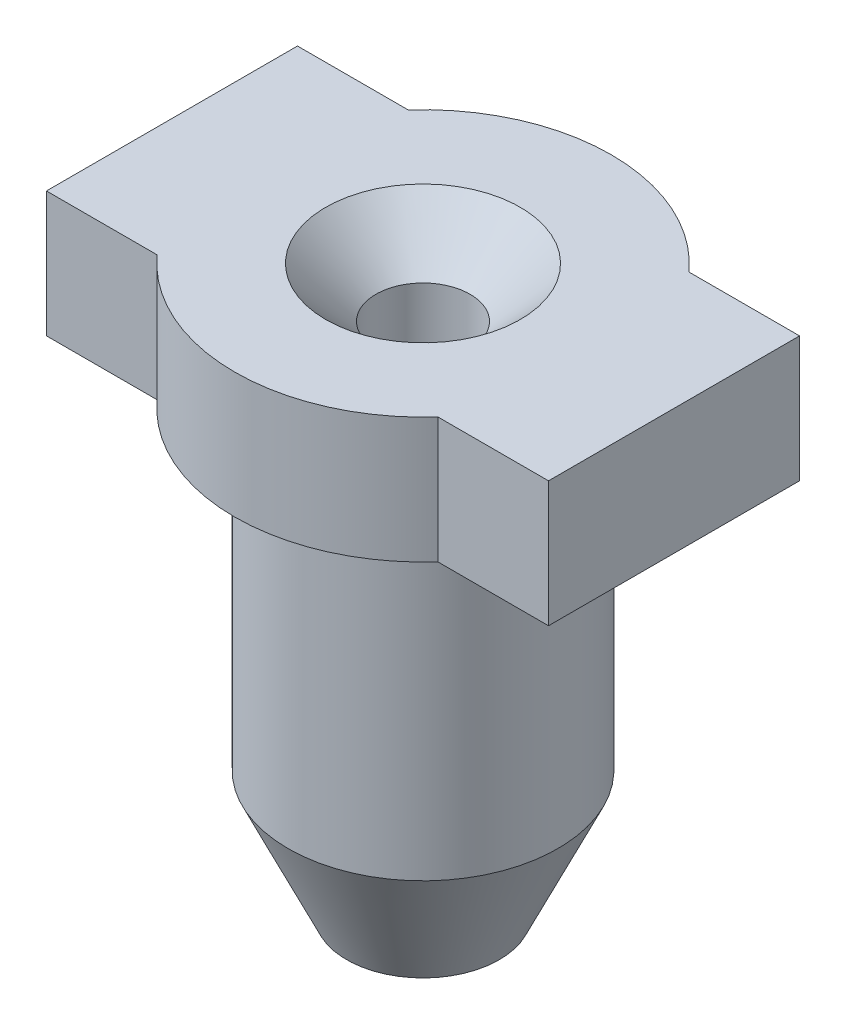
from build123d import *

# Parameters (mm, degrees)
SKETCH1_R           = 15
BOSS_EXTRUDE1_DEPTH = 10
SKETCH2_R           = 10.75
BOSS_EXTRUDE2_DEPTH = 25
SKETCH3_R           = 3.75
CUT_EXTRUDE1_DEPTH  = 28.8
SKETCH5_R           = 10.75
BOSS_EXTRUDE4_DEPTH = 10
BOSS_EXTRUDE4_TAPER = 25
CHAMFER1_SIZE       = 4
BOSS_EXTRUDE3_START = -10
SKETCH4_R           = 7.75
BOSS_EXTRUDE3_DEPTH = 10
FILLET1_R           = 3


with BuildPart() as part:
    # Sketch1 → Boss-Extrude1 (new body)
    with BuildSketch(Plane(origin=(0, 0, 0), x_dir=(1, 0, 0), z_dir=(0, 1, 0))):
        with Locations(Location((0, 0, 0), (0, 0, 270))):
            Circle(SKETCH1_R)
    extrude(amount=BOSS_EXTRUDE1_DEPTH)

    # Sketch2 → Boss-Extrude2 (add)
    with BuildSketch(Plane.XZ):
        with Locations(Location((0, 0, 0), (0, 0, 270))):
            Circle(SKETCH2_R)
    extrude(amount=BOSS_EXTRUDE2_DEPTH)

    # Sketch3 → Cut-Extrude1 (cut)
    with BuildSketch(Plane(origin=(0, 10, 0), x_dir=(1, 0, 0), z_dir=(0, 1, 0))):
        with Locations(Location((0, 0, 0), (0, 0, 270))):
            Circle(SKETCH3_R)
    extrude(amount=-CUT_EXTRUDE1_DEPTH, mode=Mode.SUBTRACT)

    # Sketch5 → Boss-Extrude4 (add)
    with BuildSketch(Plane.XZ.offset(25)):
        with Locations(Location((0, 0, 0), (0, 0, 270))):
            Circle(SKETCH5_R)
    extrude(amount=BOSS_EXTRUDE4_DEPTH, taper=BOSS_EXTRUDE4_TAPER)

    # Chamfer1
    chamfer1_edges = [part.edges().sort_by_distance(p)[0] for p in [
        (0, 10, -3.75),
    ]]
    chamfer(chamfer1_edges, length=CHAMFER1_SIZE)

    # Sketch4 → Boss-Extrude3 (add)
    # profile 1 of 3: a face of its own
    with BuildSketch(Plane(origin=(0, 10, 0), x_dir=(1, 0, 0), z_dir=(0, 1, 0)).offset(BOSS_EXTRUDE3_START)):
        with BuildLine():
            Line((-11.180339887, 10), (-20, 10))
            Line((-20, 10), (-20, -10))
            Line((-20, -10), (-11.180339887, -10))
            ThreePointArc((-11.180339887, -10), (-15, 0), (-11.180339887, 10))
        make_face()
    # profile 2 of 3: a face of its own
    with BuildSketch(Plane(origin=(0, 10, 0), x_dir=(1, 0, 0), z_dir=(0, 1, 0)).offset(BOSS_EXTRUDE3_START)):
        with BuildLine():
            Line((11.180339887, 10), (-11.180339887, 10))
            ThreePointArc((-11.180339887, 10), (-15, 0), (-11.180339887, -10))
            Line((-11.180339887, -10), (11.180339887, -10))
            ThreePointArc((11.180339887, -10), (14.012585384, -5.352331347), (15, 0))
            ThreePointArc((15, 0), (14.012585384, 5.352331347), (11.180339887, 10))
        make_face()
        Circle(SKETCH4_R, mode=Mode.SUBTRACT)
    # profile 3 of 3: a face of its own
    with BuildSketch(Plane(origin=(0, 10, 0), x_dir=(1, 0, 0), z_dir=(0, 1, 0)).offset(BOSS_EXTRUDE3_START)):
        with BuildLine():
            Line((20, 10), (11.180339887, 10))
            ThreePointArc((11.180339887, 10), (14.012585384, 5.352331347), (15, 0))
            ThreePointArc((15, 0), (14.012585384, -5.352331347), (11.180339887, -10))
            Line((11.180339887, -10), (20, -10))
            Line((20, -10), (20, 10))
        make_face()
    extrude(amount=BOSS_EXTRUDE3_DEPTH)

    # Fillet1
    fillet1_edges = [part.edges().sort_by_distance(p)[0] for p in [
        (0, 0, 10.75),
    ]]
    fillet(fillet1_edges, radius=FILLET1_R)


solid = part.part
